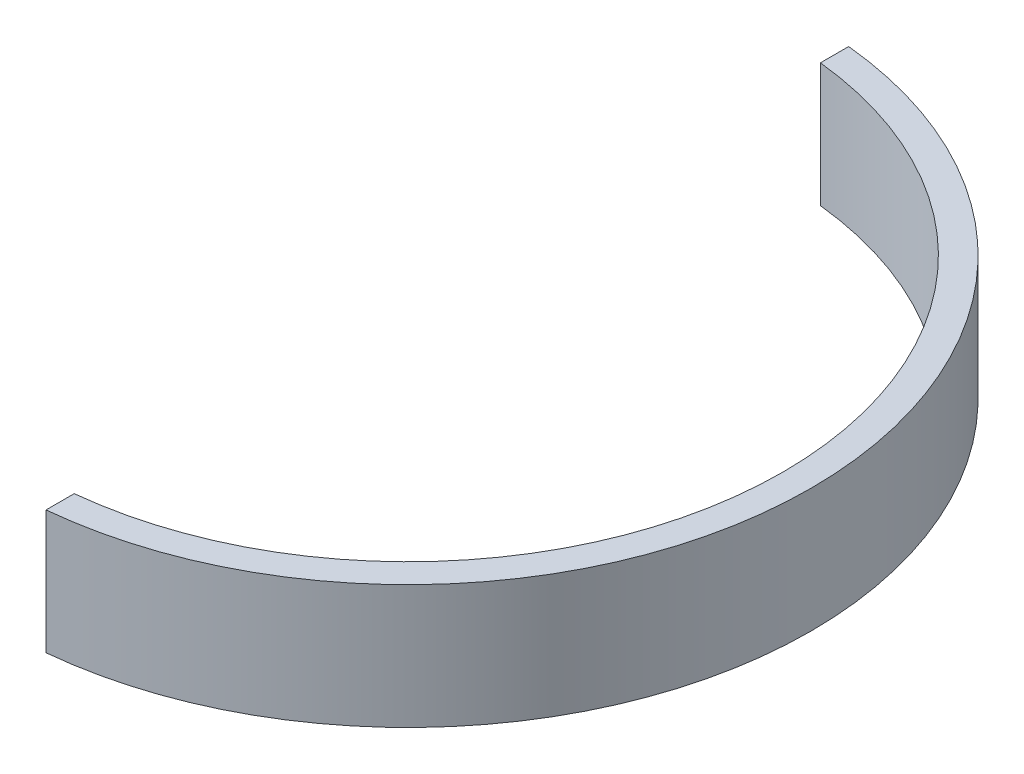
from build123d import *

# Parameters (mm, degrees)
BOSS_EXTRUDE1_DEPTH = 22.04


with BuildPart() as part:
    # Sketch1 → Boss-Extrude1 (new body)
    with BuildSketch(Plane(origin=(0, 0, 0), x_dir=(1, 0, 0), z_dir=(0, 1, 0))):
        with BuildLine():
            Line((7.036, 66.473669441), (7.036, 71.499641461))
            ThreePointArc((7.036, 71.499641461), (71.845, 0), (7.036, -71.499641461))
            Line((7.036, -71.499641461), (7.036, -66.473669441))
            ThreePointArc((7.036, -66.473669441), (66.845, 0), (7.036, 66.473669441))
        make_face()
    extrude(amount=BOSS_EXTRUDE1_DEPTH)


solid = part.part
